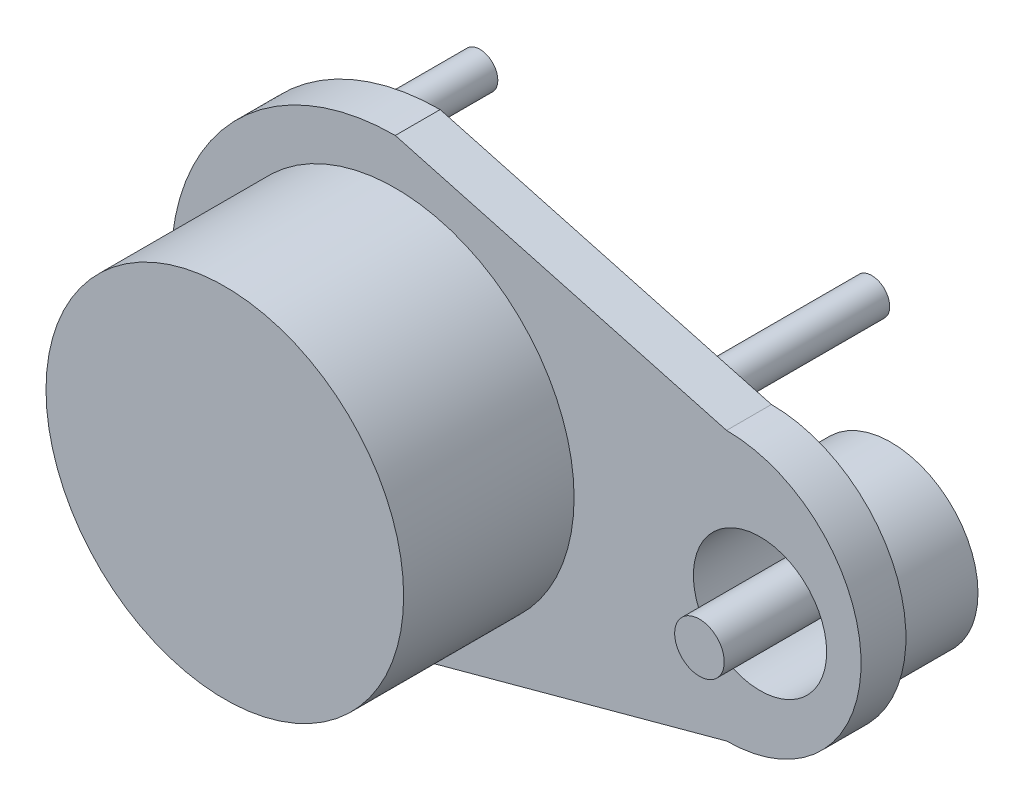
from build123d import *

# Parameters (mm, degrees)
BOSS_EXTRUDE1_DEPTH  = 0.75
SKETCH2_R            = 1.453519805
BOSS_EXTRUDE2_DEPTH  = 1.35
M2_CLEARANCE_HOLE1_D = 2.22821008
SKETCH5_R            = 0.414358547
BOSS_EXTRUDE3_DEPTH  = 1.8
SKETCH6_R            = 0.3
BOSS_EXTRUDE4_DEPTH  = 3
SKETCH7_R            = 0.3
BOSS_EXTRUDE5_DEPTH  = 3
SKETCH8_R            = 0.3
BOSS_EXTRUDE6_DEPTH  = 3
SKETCH9_R            = 0.3
BOSS_EXTRUDE7_DEPTH  = 3
SKETCH10_W           = 2.989968033
SKETCH10_H           = 2.85


with BuildPart() as part:
    # Sketch1 → Boss-Extrude1 (new body)
    with BuildSketch(Plane.XY.offset(0.75)):
        with BuildLine():
            Line((0, -3.75), (5.539283427, -2.24917213))
            ThreePointArc((5.539283427, -2.24917213), (7.788455557, 0), (5.539283427, 2.24917213))
            Line((5.539283427, 2.24917213), (0, 3.75))
            ThreePointArc((0, 3.75), (-3.75, 0), (0, -3.75))
        make_face()
    extrude(amount=-BOSS_EXTRUDE1_DEPTH)

    # Sketch2 → Boss-Extrude2 (add)
    with BuildSketch(Plane(origin=(0, 0, 0), x_dir=(-1, 0, 0), z_dir=(0, 0, -1))):
        with Locations(Location((-6.189903002, -0.101269822, 0), (0, 0, 180))):
            Circle(SKETCH2_R)
    extrude(amount=BOSS_EXTRUDE2_DEPTH)

    # M2 Clearance Hole1 (through all)
    with Locations(Plane.XY.offset(0.75)):
        with Locations((6.098758585, -0.125150984)):
            Hole(M2_CLEARANCE_HOLE1_D / 2)

    # Sketch6 → Boss-Extrude4 (add)
    with BuildSketch(Plane(origin=(0, 0, 0), x_dir=(-1, 0, 0), z_dir=(0, 0, -1))):
        with Locations(Location((-4.194127883, -1.193925315, 0), (0, 0, 180))):
            Circle(SKETCH6_R)
    extrude(amount=BOSS_EXTRUDE4_DEPTH)

    # Sketch7 → Boss-Extrude5 (add)
    with BuildSketch(Plane(origin=(0, 0, 0), x_dir=(-1, 0, 0), z_dir=(0, 0, -1))):
        with Locations(Location((2.322145059, -1.193925315, 0), (0, 0, 180))):
            Circle(SKETCH7_R)
    extrude(amount=BOSS_EXTRUDE5_DEPTH)

    # Sketch8 → Boss-Extrude6 (add)
    with BuildSketch(Plane(origin=(0, 0, 0), x_dir=(-1, 0, 0), z_dir=(0, 0, -1))):
        with Locations(Location((-4.217003228, 1.656061577, 0), (0, 0, 180))):
            Circle(SKETCH8_R)
    extrude(amount=BOSS_EXTRUDE6_DEPTH)

    # Sketch9 → Boss-Extrude7 (add)
    with BuildSketch(Plane(origin=(0, 0, 0), x_dir=(-1, 0, 0), z_dir=(0, 0, -1))):
        with Locations(Location((2.335500338, 1.656061577, 0), (0, 0, 180))):
            Circle(SKETCH9_R)
    extrude(amount=BOSS_EXTRUDE7_DEPTH)

    # Sketch10 → Revolve1 (revolve)
    with BuildSketch(Plane.XZ, mode=Mode.PRIVATE) as revolve1_sk:
        with Locations((1.494984017, 2.175)):
            Rectangle(SKETCH10_W, SKETCH10_H)
    revolve(revolve1_sk.sketch.rotate(Axis((0, 0, 3.6), (0, 0, -1)), 180), axis=Axis((0, 0, 3.6), (0, 0, -1)))


with BuildPart() as body_2:
    # Sketch5 → Boss-Extrude3 (new body)
    with BuildSketch(Plane(origin=(0, 0, 0), x_dir=(-1, 0, 0), z_dir=(0, 0, -1))):
        with Locations(Location((-6.136062205, -0.07392106, 0), (0, 0, 180))):
            Circle(SKETCH5_R)
    extrude(amount=-BOSS_EXTRUDE3_DEPTH)


solid = Compound([part.part, body_2.part])
